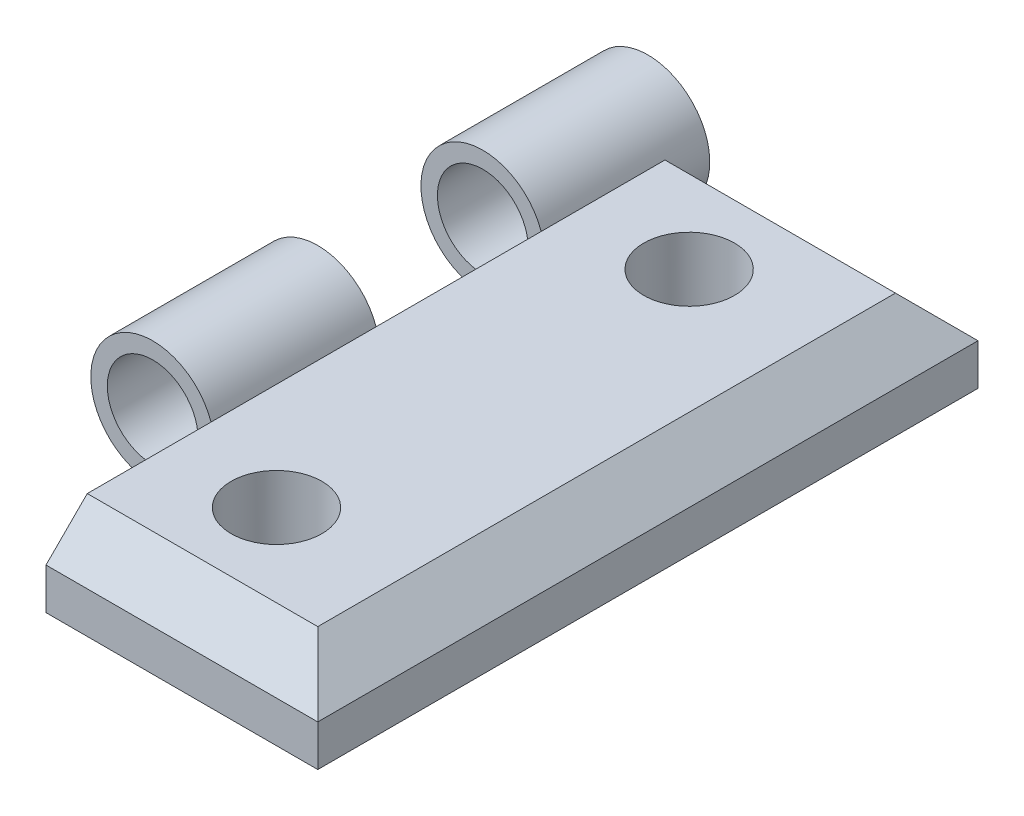
from build123d import *

# Parameters (mm, degrees)
IZIM1_R                     = 2.75
Y_KSEKLIK_EKSTR_ZYON1_DEPTH = 40
IZIM2_R                     = 2.75
IZIM2_W                     = 7.285533906
IZIM2_H                     = 10
KES_EKSTR_ZYON1_DEPTH       = 40
PAH1_SIZE                   = 2.5


with BuildPart() as part:
    # Çizim1 → Yükseklik-Ekstrüzyon1 (new body)
    with BuildSketch(Plane.XY):
        with BuildLine():
            Line((-4.545775403, 5), (11.152492002, 5))
            Line((11.152492002, 5), (11.152492002, 0))
            Line((11.152492002, 0), (-8.847507998, 0))
            ThreePointArc((-8.847507998, 0), (-11.909370176, 5.915063509), (-5.311974092, 5))
            Line((-5.311974092, 5), (-4.545775403, 5))
        make_face()
        with Locations((-8.847507998, 3.75)):
            Circle(IZIM1_R, mode=Mode.SUBTRACT)
    extrude(amount=Y_KSEKLIK_EKSTR_ZYON1_DEPTH)

    # Çizim2 → Kes-Ekstrüzyon1 (cut)
    with BuildSketch(Plane(origin=(0, 0, 0), x_dir=(1, 0, 0), z_dir=(0, 1, 0))):
        with Locations(Location((1.152492002, -7.5, 0), (0, 0, 90))):
            Circle(IZIM2_R)
        with Locations(Location((1.152492002, -32.5, 0), (0, 0, 90))):
            Circle(IZIM2_R)
        with Locations((-8.954741045, -35)):
            Rectangle(IZIM2_W, IZIM2_H)
        with Locations((-8.954741045, -15)):
            Rectangle(IZIM2_W, IZIM2_H)
    extrude(amount=KES_EKSTR_ZYON1_DEPTH, mode=Mode.SUBTRACT)

    # Pah1
    pah1_edges = [part.edges().sort_by_distance(p)[0] for p in [
        (2.920258955, 5, 40),
        (2.920258955, 5, 0),
        (11.152492002, 5, 20),
    ]]
    chamfer(pah1_edges, length=PAH1_SIZE)


solid = part.part
